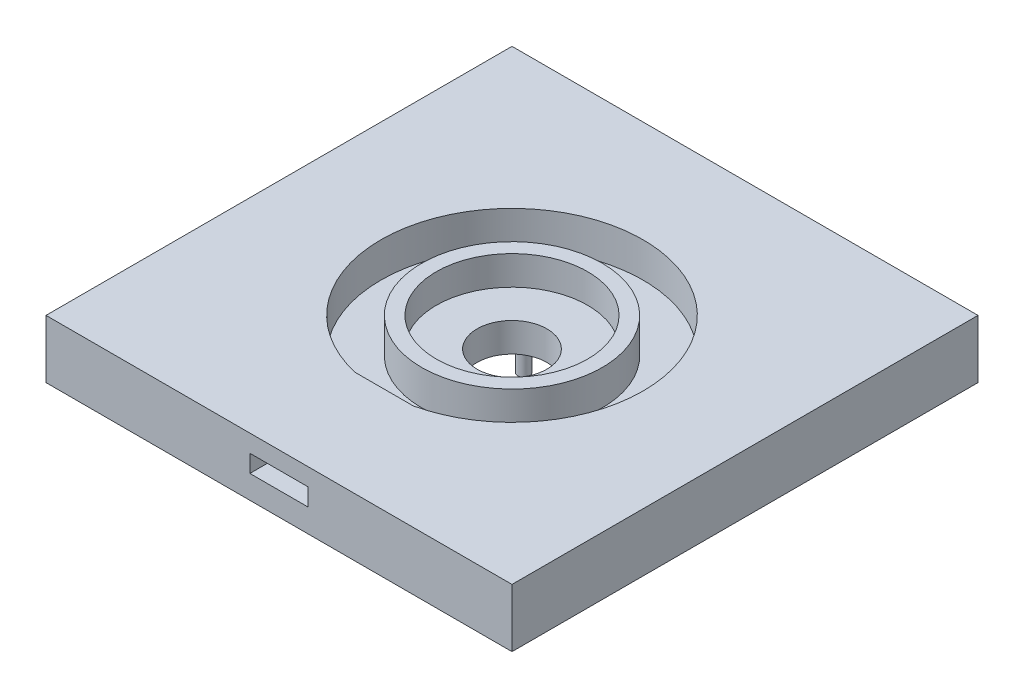
from build123d import *

# Parameters (mm, degrees)
SKETCH28_W                                   = 80
SKETCH28_H                                   = 80
BOSS_EXTRUDE1_DEPTH                          = 10
CBORE_FOR_M10_CHEESE_HEAD_SCREW1_D           = 12
CBORE_FOR_M10_CHEESE_HEAD_SCREW1_CBORE_D     = 26
CBORE_FOR_M10_CHEESE_HEAD_SCREW1_CBORE_DEPTH = 5
SKETCH36_R                                   = 1
BOSS_EXTRUDE5_DEPTH                          = 10
SKETCH37_R                                   = 22.5
SKETCH37_R_2                                 = 15.5
CUT_EXTRUDE2_DEPTH                           = 6
CUT_EXTRUDE6_DEPTH                           = 6
SKETCH40_W                                   = 18.062589032
SKETCH40_H                                   = 3
BOSS_EXTRUDE7_DEPTH                          = 13


with BuildPart() as part:
    # Sketch28 → Boss-Extrude1 (new body)
    with BuildSketch(Plane(origin=(0, 0, 0), x_dir=(1, 0, 0), z_dir=(0, 1, 0))):
        with Locations((1.944585414, 4.241283073)):
            Rectangle(SKETCH28_W, SKETCH28_H)
    extrude(amount=BOSS_EXTRUDE1_DEPTH)

    # CBORE for M10 Cheese Head Screw1 (through all)
    with Locations(Plane(origin=(0, 10, 0), x_dir=(1, 0, 0), z_dir=(0, 1, 0))):
        with Locations((1.944585414, 4.241283073)):
            CounterBoreHole(CBORE_FOR_M10_CHEESE_HEAD_SCREW1_D / 2, CBORE_FOR_M10_CHEESE_HEAD_SCREW1_CBORE_D / 2, CBORE_FOR_M10_CHEESE_HEAD_SCREW1_CBORE_DEPTH)

    # Sketch36 → Boss-Extrude5 (add)
    with BuildSketch(Plane.XZ):
        with Locations(Location((12.444585414, -16.741283073, 0), (0, 0, 270))):
            Circle(SKETCH36_R)
        with Locations(Location((12.444585414, -4.241283073, 0), (0, 0, 270))):
            Circle(SKETCH36_R)
        with Locations(Location((-8.555414586, -16.741283073, 0), (0, 0, 90))):
            Circle(SKETCH36_R)
        with Locations(Location((-8.555414586, -4.241283073, 0), (0, 0, 90))):
            Circle(SKETCH36_R)
    extrude(amount=BOSS_EXTRUDE5_DEPTH)

    # Sketch37 → Cut-Extrude2 (cut)
    with BuildSketch(Plane(origin=(0, 10, 0), x_dir=(1, 0, 0), z_dir=(0, 1, 0))):
        with Locations(Location((1.944585414, 4.241283073, 0), (0, 0, 270))):
            Circle(SKETCH37_R)
        with Locations(Location((1.944585414, 4.241283073, 0), (0, 0, 270))):
            Circle(SKETCH37_R_2, mode=Mode.SUBTRACT)
    extrude(amount=-CUT_EXTRUDE2_DEPTH, mode=Mode.SUBTRACT)

    # Sketch39 → Cut-Extrude6 (cut)
    with BuildSketch(Plane(origin=(0, 10, 0), x_dir=(1, 0, 0), z_dir=(0, 1, 0))):
        with BuildLine():
            Line((6.944585414, -35.758716927), (6.944585414, -17.696127895))
            ThreePointArc((6.944585414, -17.696127895), (1.944585414, -18.258716927), (-3.055414586, -17.696127895))
            Line((-3.055414586, -17.696127895), (-3.055414586, -35.758716927))
            Line((-3.055414586, -35.758716927), (1.944585414, -35.758716927))
            Line((1.944585414, -35.758716927), (6.944585414, -35.758716927))
        make_face()
    extrude(amount=-CUT_EXTRUDE6_DEPTH, mode=Mode.SUBTRACT)

    # Sketch40 → Boss-Extrude7 (add)
    with BuildSketch(Plane(origin=(-3.055414586, 0, 0), x_dir=(0, 0, -1), z_dir=(1, 0, 0))):
        with Locations((-26.727422411, 8.5)):
            Rectangle(SKETCH40_W, SKETCH40_H)
    extrude(amount=BOSS_EXTRUDE7_DEPTH)


solid = part.part
